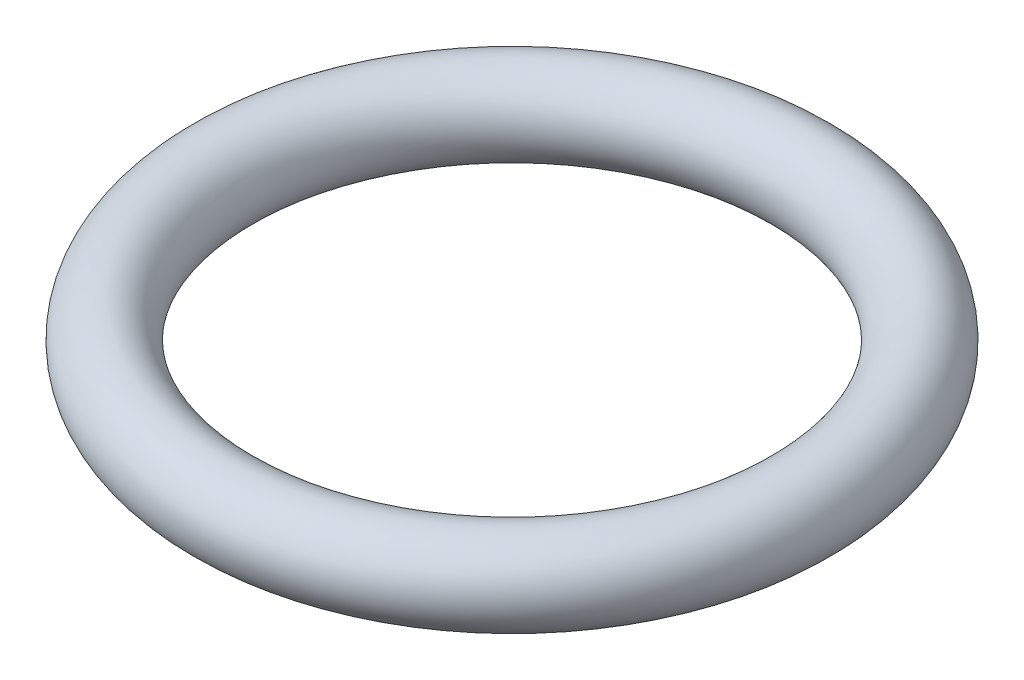
from build123d import *

# Parameters (mm, degrees)
ESQUISSE1_R = 0.5


with BuildPart() as part:
    # Esquisse1 → Base-Révolution (revolve)
    with BuildSketch(Plane.XY):
        with Locations((3.5, 0)):
            Circle(ESQUISSE1_R)
    revolve(axis=Axis((0, 22.936744639, 0), (0, -1, 0)))


solid = part.part
